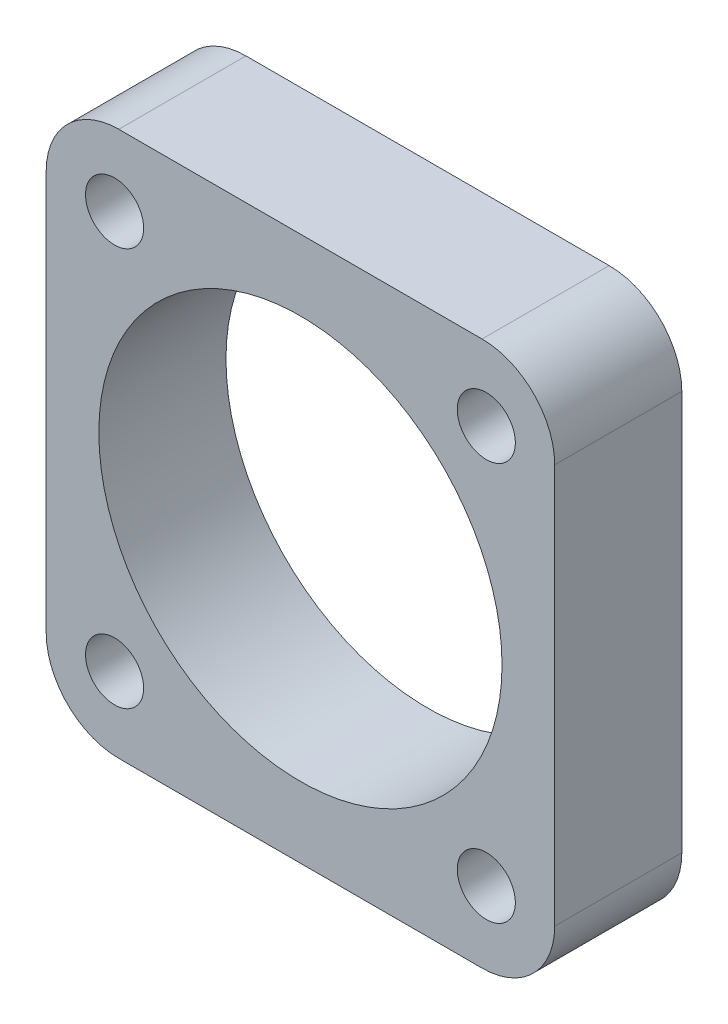
from build123d import *

# Parameters (mm, degrees)
SKETCH1_W           = 28
SKETCH1_H           = 30
SKETCH1_R           = 11.1
SKETCH1_R_2         = 1.6
BOSS_EXTRUDE1_DEPTH = 7
SKETCH1_4_R         = 1.6
CUT_EXTRUDE3_DEPTH  = 3
FILLET5_R           = 4


with BuildPart() as part:
    # Sketch1 → Boss-Extrude1 (new body)
    with BuildSketch(Plane.XY):
        Rectangle(SKETCH1_W, SKETCH1_H)
        Circle(SKETCH1_R, mode=Mode.SUBTRACT)
        with Locations((-10.234773755, -10.965829024)):
            Circle(SKETCH1_R_2, mode=Mode.SUBTRACT)
        with Locations((10.234773755, -10.965829024)):
            Circle(SKETCH1_R_2, mode=Mode.SUBTRACT)
        with Locations((-10.234773755, 10.965829024)):
            Circle(SKETCH1_R_2, mode=Mode.SUBTRACT)
        with Locations((10.234773755, 10.965829024)):
            Circle(SKETCH1_R_2, mode=Mode.SUBTRACT)
    extrude(amount=BOSS_EXTRUDE1_DEPTH)

    # Sketch1<4> → Cut-Extrude3 (cut)
    # profile 1 of 4: a face of its own
    with BuildSketch(Plane.XY):
        Polygon((-13.134773755, 9.291513243), (-10.234773755, 7.617197462), (-7.334773755, 9.291513243), (-7.334773755, 12.640144804), (-10.234773755, 14.314460585), (-13.134773755, 12.640144804), align=None)
        with Locations((-10.234773755, 10.965829024)):
            Circle(SKETCH1_4_R, mode=Mode.SUBTRACT)
    # profile 2 of 4: a face of its own
    with BuildSketch(Plane.XY):
        Polygon((10.234773755, 7.617197462), (13.134773755, 9.291513243), (13.134773755, 12.640144804), (10.234773755, 14.314460585), (7.334773755, 12.640144804), (7.334773755, 9.291513243), align=None)
        with Locations((10.234773755, 10.965829024)):
            Circle(SKETCH1_4_R, mode=Mode.SUBTRACT)
    # profile 3 of 4: a face of its own
    with BuildSketch(Plane.XY):
        Polygon((-7.334773755, -9.291513243), (-10.234773755, -7.617197462), (-13.134773755, -9.291513243), (-13.134773755, -12.640144804), (-10.234773755, -14.314460585), (-7.334773755, -12.640144804), align=None)
        with Locations((-10.234773755, -10.965829024)):
            Circle(SKETCH1_4_R, mode=Mode.SUBTRACT)
    # profile 4 of 4: a face of its own
    with BuildSketch(Plane.XY):
        Polygon((13.134773755, -12.640144804), (13.134773755, -9.291513243), (10.234773755, -7.617197462), (7.334773755, -9.291513243), (7.334773755, -12.640144804), (10.234773755, -14.314460585), align=None)
        with Locations((10.234773755, -10.965829024)):
            Circle(SKETCH1_4_R, mode=Mode.SUBTRACT)
    extrude(amount=CUT_EXTRUDE3_DEPTH, mode=Mode.SUBTRACT)

    # Fillet5
    fillet5_edges = [part.edges().sort_by_distance(p)[0] for p in [
        (-14, 15, 3.5),
        (-14, -15, 3.5),
        (14, 15, 3.5),
        (14, -15, 3.5),
    ]]
    fillet(fillet5_edges, radius=FILLET5_R)


solid = part.part
